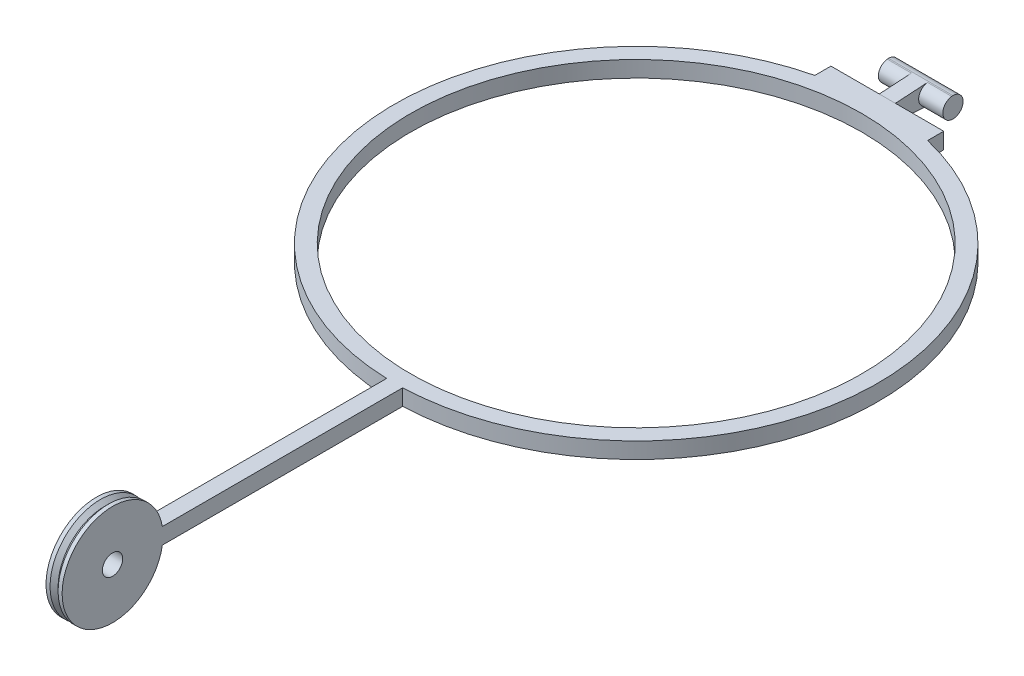
from build123d import *

# Parameters (mm, degrees)
BOSS_EXTRUDE1_REACH     = 30.816
SKETCH2_R               = 4
BOSS_EXTRUDE4_DEPTH     = 6.35
CUT_EXTRUDE1_DEPTH      = 325.659613706
CUT_EXTRUDE1_DEPTH_BACK = 325.659613706
BOSS_EXTRUDE5_DEPTH     = 3.175
BOSS_EXTRUDE6_DEPTH     = 12.7


with BuildPart() as part:
    # Sketch1 → Revolve1 (revolve)
    with BuildSketch(Plane.XY, mode=Mode.PRIVATE) as revolve1_sk:
        Polygon((0, 4), (6.35, 4), (6.35, 19.875), (4.7625, 19.875), (3.175, 18.2875), (1.5875, 19.875), (0, 19.875), align=None)
    revolve(revolve1_sk.sketch.rotate(Axis((0, 0, 0), (1, 0, 0)), 90), axis=Axis((0, 0, 0), (1, 0, 0)))

    # Boss-Extrude1: up to this face of the body (flat: up to its plane)
    boss_extrude1_end = Plane(part.part.faces().sort_by_distance((0, 0, -19.312850109))[0])
    # Sketch2 → Boss-Extrude1 (add, up to the picked face)
    with BuildSketch(Plane(origin=(6.35, 0, 0), x_dir=(0, 0, -1), z_dir=(1, 0, 0)), mode=Mode.PRIVATE) as boss_extrude1_sk1:
        with BuildLine():
            Line((20.028068585, 3.175), (304.8, 3.175))
            Line((304.8, 3.175), (304.8, 0))
            Line((304.8, 0), (304.8, -3.175))
            Line((304.8, -3.175), (20.028068585, -3.175))
            ThreePointArc((20.028068585, -3.175), (18.498150057, -3.687452393), (17.585562562, -5.018032049))
            ThreePointArc((17.585562562, -5.018032049), (-18.2875, 0), (17.585562562, 5.018032049))
            ThreePointArc((17.585562562, 5.018032049), (18.498150057, 3.687452393), (20.028068585, 3.175))
        make_face()
        with Locations(Location((0, 0, 0), (0, 0, 180))):
            Circle(SKETCH2_R, mode=Mode.SUBTRACT)
    boss_extrude1_tool1 = split(extrude(boss_extrude1_sk1.sketch, amount=-BOSS_EXTRUDE1_REACH, mode=Mode.PRIVATE), bisect_by=boss_extrude1_end, keep=Keep.BOTH, mode=Mode.PRIVATE)
    add(boss_extrude1_tool1.solids().sort_by(Axis((6.35, 0, -104.167204), (-1, 0, 0)))[0])

    # Sketch6 → Boss-Extrude4 (add)
    with BuildSketch(Plane.XZ.offset(3.175)):
        with BuildLine():
            ThreePointArc((0, -114.352931374), (-91.58879889, -199.938292555), (-19.05, -302.170796126))
            ThreePointArc((-19.05, -302.170796126), (-9.590159419, -303.940747454), (0, -304.747068626))
            Line((0, -304.747068626), (0, -298.393285481))
            ThreePointArc((0, -298.393285481), (-85.725, -209.55), (0, -120.706714519))
            Line((0, -120.706714519), (0, -114.352931374))
        make_face()
        with BuildLine():
            ThreePointArc((98.425, -209.55), (71.640251223, -143.330124774), (6.35, -114.352931374))
            Line((6.35, -114.352931374), (6.35, -120.706714519))
            ThreePointArc((6.35, -120.706714519), (67.149477333, -147.820944848), (92.075, -209.55))
            ThreePointArc((92.075, -209.55), (67.149477333, -271.279055152), (6.35, -298.393285481))
            Line((6.35, -298.393285481), (6.35, -304.747068626))
            ThreePointArc((6.35, -304.747068626), (15.940159419, -303.940747454), (25.4, -302.170796126))
            ThreePointArc((25.4, -302.170796126), (77.973040583, -268.523007597), (98.425, -209.55))
        make_face()
        with BuildLine():
            ThreePointArc((0, -304.747068626), (-9.590159419, -303.940747454), (-19.05, -302.170796126))
            Line((-19.05, -302.170796126), (-19.05, -308.520796126))
            Line((-19.05, -308.520796126), (25.4, -308.520796126))
            Line((25.4, -308.520796126), (25.4, -302.170796126))
            ThreePointArc((25.4, -302.170796126), (15.940159419, -303.940747454), (6.35, -304.747068626))
            Line((6.35, -304.747068626), (6.35, -304.8))
            Line((6.35, -304.8), (3.175, -304.8))
            Line((3.175, -304.8), (0, -304.8))
            Line((0, -304.8), (0, -304.747068626))
        make_face()
    extrude(amount=-BOSS_EXTRUDE4_DEPTH)

    # Sketch6<4> → Cut-Extrude1 (cut, two sides: drawn at the far end of the back side and taken through both)
    with BuildSketch(Plane.XZ.offset(3.175).offset(-CUT_EXTRUDE1_DEPTH_BACK)):
        with BuildLine():
            ThreePointArc((0, -298.393285481), (1.58724675, -298.435820239), (3.175, -298.45))
            Line((3.175, -298.45), (3.175, -120.65))
            ThreePointArc((3.175, -120.65), (1.58724675, -120.664179761), (0, -120.706714519))
            Line((0, -120.706714519), (0, -298.393285481))
        make_face()
        with BuildLine():
            Line((3.175, -120.65), (3.175, -298.45))
            ThreePointArc((3.175, -298.45), (4.76275325, -298.435820239), (6.35, -298.393285481))
            Line((6.35, -298.393285481), (6.35, -120.706714519))
            ThreePointArc((6.35, -120.706714519), (4.76275325, -120.664179761), (3.175, -120.65))
        make_face()
    extrude(amount=CUT_EXTRUDE1_DEPTH + CUT_EXTRUDE1_DEPTH_BACK, mode=Mode.SUBTRACT)

    # Sketch8 → Boss-Extrude5 (add, symmetric)
    with BuildSketch(Plane.ZY.offset(-3.175)):
        with BuildLine():
            Line((-308.520796126, -3.175), (-308.520796126, 3.175))
            Line((-308.520796126, 3.175), (-321.183816784, 3.96869459))
            ThreePointArc((-321.183816784, 3.96869459), (-318.683458763, 2.645954285), (-317.683279744, 0))
            ThreePointArc((-317.683279744, 0), (-318.683458763, -2.645954285), (-321.183816784, -3.96869459))
            Line((-321.183816784, -3.96869459), (-308.520796126, -3.175))
        make_face()
    extrude(amount=BOSS_EXTRUDE5_DEPTH, both=True)

    # Sketch8<3> → Boss-Extrude6 (add, symmetric)
    with BuildSketch(Plane.ZY.offset(-3.175)):
        with BuildLine():
            ThreePointArc((-317.683279744, 0), (-318.683458763, 2.645954285), (-321.183816784, 3.96869459))
            Line((-321.183816784, 3.96869459), (-321.683279744, 4))
            ThreePointArc((-321.683279744, 4), (-325.683279744, 0), (-321.683279744, -4))
            Line((-321.683279744, -4), (-321.183816784, -3.96869459))
            ThreePointArc((-321.183816784, -3.96869459), (-318.683458763, -2.645954285), (-317.683279744, 0))
        make_face()
    extrude(amount=BOSS_EXTRUDE6_DEPTH, both=True)


solid = part.part
